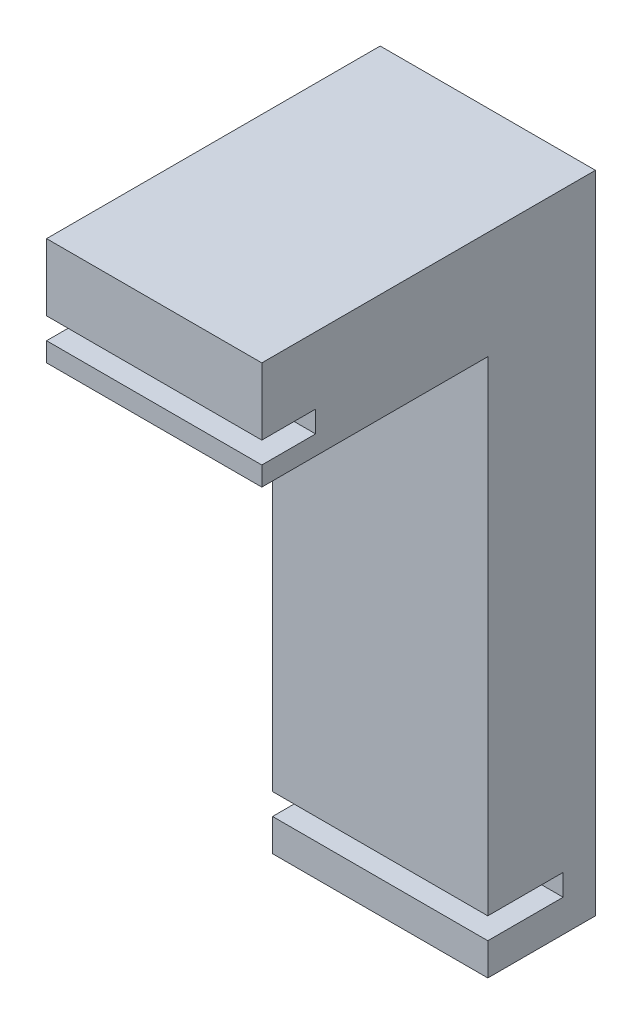
from build123d import *

# Parameters (mm, degrees)
CROQUIS1_W              = 20
CROQUIS1_H              = 60
SALIENTE_EXTRUIR1_DEPTH = 31
CORTAR_EXTRUIR1_REACH   = 72.434
CROQUIS2_W              = 21
CROQUIS2_H              = 50
CORTAR_EXTRUIR2_REACH   = 72.434
CROQUIS3_W              = 5
CROQUIS3_H              = 2
CORTAR_EXTRUIR3_REACH   = 72.434
CROQUIS4_W              = 7
CROQUIS4_H              = 2


with BuildPart() as part:
    # Croquis1 → Saliente-Extruir1 (new body)
    with BuildSketch(Plane.XY):
        with Locations((10, 30)):
            Rectangle(CROQUIS1_W, CROQUIS1_H)
    extrude(amount=SALIENTE_EXTRUIR1_DEPTH)

    # Croquis2 → Cortar-Extruir1 (cut, up to next)
    with BuildSketch(Plane(origin=(20, 0, 0), x_dir=(0, 0, -1), z_dir=(1, 0, 0)), mode=Mode.PRIVATE) as cortar_extruir1_sk1:
        with Locations((-20.5, 25)):
            Rectangle(CROQUIS2_W, CROQUIS2_H)
    cortar_extruir1_tool1 = extrude(cortar_extruir1_sk1.sketch, amount=-CORTAR_EXTRUIR1_REACH, mode=Mode.PRIVATE) & part.part
    add(cortar_extruir1_tool1.solids().sort_by_distance((20, 25, 20.5))[0], mode=Mode.SUBTRACT)

    # Croquis3 → Cortar-Extruir2 (cut, up to next)
    with BuildSketch(Plane(origin=(20, 0, 0), x_dir=(0, 0, -1), z_dir=(1, 0, 0)), mode=Mode.PRIVATE) as cortar_extruir2_sk1:
        with Locations((-28.5, 52.783625731)):
            Rectangle(CROQUIS3_W, CROQUIS3_H)
    cortar_extruir2_tool1 = extrude(cortar_extruir2_sk1.sketch, amount=-CORTAR_EXTRUIR2_REACH, mode=Mode.PRIVATE) & part.part
    add(cortar_extruir2_tool1.solids().sort_by_distance((20, 52.783626, 28.5))[0], mode=Mode.SUBTRACT)

    # Croquis4 → Cortar-Extruir3 (cut, up to next)
    with BuildSketch(Plane(origin=(20, 0, 0), x_dir=(0, 0, -1), z_dir=(1, 0, 0)), mode=Mode.PRIVATE) as cortar_extruir3_sk1:
        with Locations((-6.5, 4)):
            Rectangle(CROQUIS4_W, CROQUIS4_H)
    cortar_extruir3_tool1 = extrude(cortar_extruir3_sk1.sketch, amount=-CORTAR_EXTRUIR3_REACH, mode=Mode.PRIVATE) & part.part
    add(cortar_extruir3_tool1.solids().sort_by_distance((20, 4, 6.5))[0], mode=Mode.SUBTRACT)


solid = part.part
